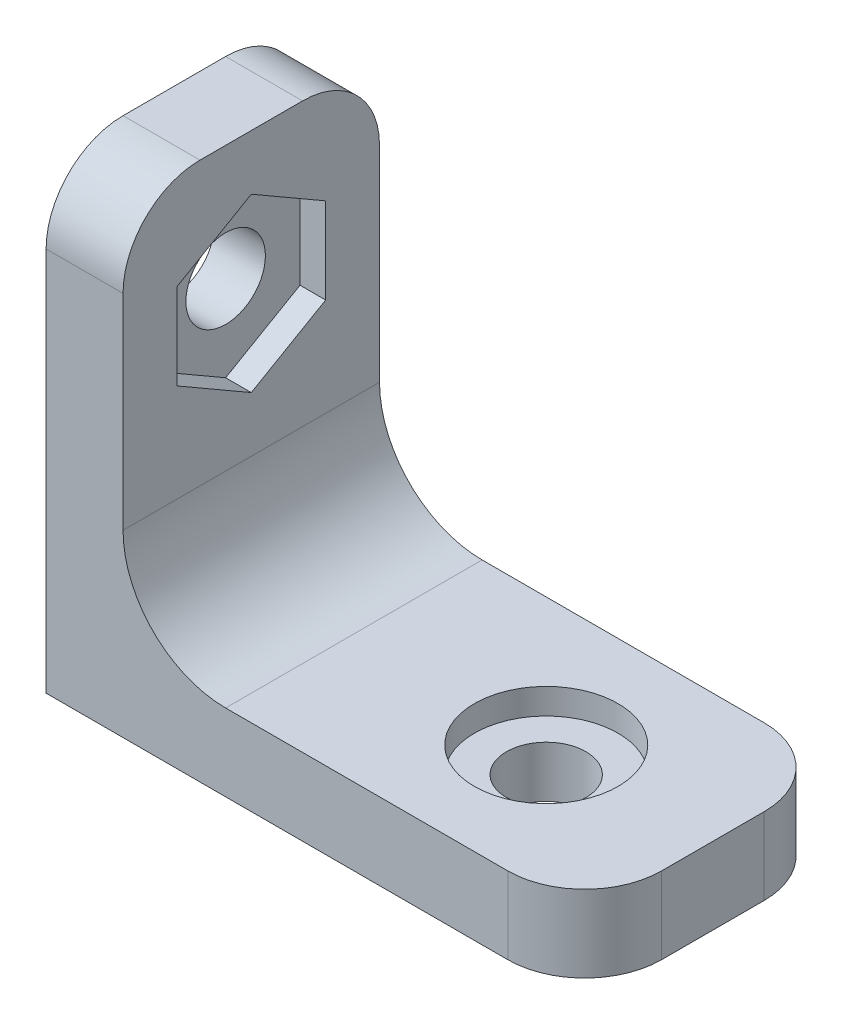
from build123d import *

# Parameters (mm, degrees)
CROQUIS1_W              = 21
CROQUIS1_H              = 10
CROQUIS1_R              = 1.55
SALIENTE_EXTRUIR1_DEPTH = 3
CROQUIS2_W              = 3
CROQUIS2_H              = 10
SALIENTE_EXTRUIR2_DEPTH = 15
CROQUIS3_R              = 1.55
CORTAR_EXTRUIR1_DEPTH   = 3
CROQUIS4_R              = 2.8
CORTAR_EXTRUIR2_DEPTH   = 1
CORTAR_EXTRUIR3_DEPTH   = 1
REDONDEO1_R             = 3
REDONDEO2_R             = 4


with BuildPart() as part:
    # Croquis1 → Saliente-Extruir1 (new body)
    with BuildSketch(Plane(origin=(0, 0, 0), x_dir=(1, 0, 0), z_dir=(0, 1, 0))):
        with Locations((10.5, 5)):
            Rectangle(CROQUIS1_W, CROQUIS1_H)
        with Locations(Location((14.5, 5, 0), (0, 0, 270))):
            Circle(CROQUIS1_R, mode=Mode.SUBTRACT)
    extrude(amount=SALIENTE_EXTRUIR1_DEPTH)

    # Croquis2 → Saliente-Extruir2 (add)
    with BuildSketch(Plane(origin=(0, 3, 0), x_dir=(1, 0, 0), z_dir=(0, 1, 0))):
        with Locations((1.5, 5)):
            Rectangle(CROQUIS2_W, CROQUIS2_H)
    extrude(amount=SALIENTE_EXTRUIR2_DEPTH)

    # Croquis3 → Cortar-Extruir1 (cut)
    with BuildSketch(Plane.ZY):
        with Locations((-5, 12.5)):
            Circle(CROQUIS3_R)
    extrude(amount=-CORTAR_EXTRUIR1_DEPTH, mode=Mode.SUBTRACT)

    # Croquis4 → Cortar-Extruir2 (cut)
    with BuildSketch(Plane(origin=(0, 3, 0), x_dir=(1, 0, 0), z_dir=(0, 1, 0))):
        with Locations(Location((14.5, 5, 0), (0, 0, 270))):
            Circle(CROQUIS4_R)
    extrude(amount=-CORTAR_EXTRUIR2_DEPTH, mode=Mode.SUBTRACT)

    # Croquis5 → Cortar-Extruir3 (cut)
    with BuildSketch(Plane(origin=(3, 0, 0), x_dir=(0, 0, -1), z_dir=(1, 0, 0))):
        Polygon((7.9, 14.174315781), (5, 15.848631561), (2.1, 14.174315781), (2.1, 10.825684219), (5, 9.151368439), (7.9, 10.825684219), align=None)
    extrude(amount=-CORTAR_EXTRUIR3_DEPTH, mode=Mode.SUBTRACT)

    # Redondeo1
    redondeo1_edges = [part.edges().sort_by_distance(p)[0] for p in [
        (1.5, 18, 0),
        (1.5, 18, -10),
        (21, 1.5, -10),
        (21, 1.5, 0),
    ]]
    fillet(redondeo1_edges, radius=REDONDEO1_R)

    # Redondeo2
    redondeo2_edges = [part.edges().sort_by_distance(p)[0] for p in [
        (3, 3, -5),
    ]]
    fillet(redondeo2_edges, radius=REDONDEO2_R)


solid = part.part
